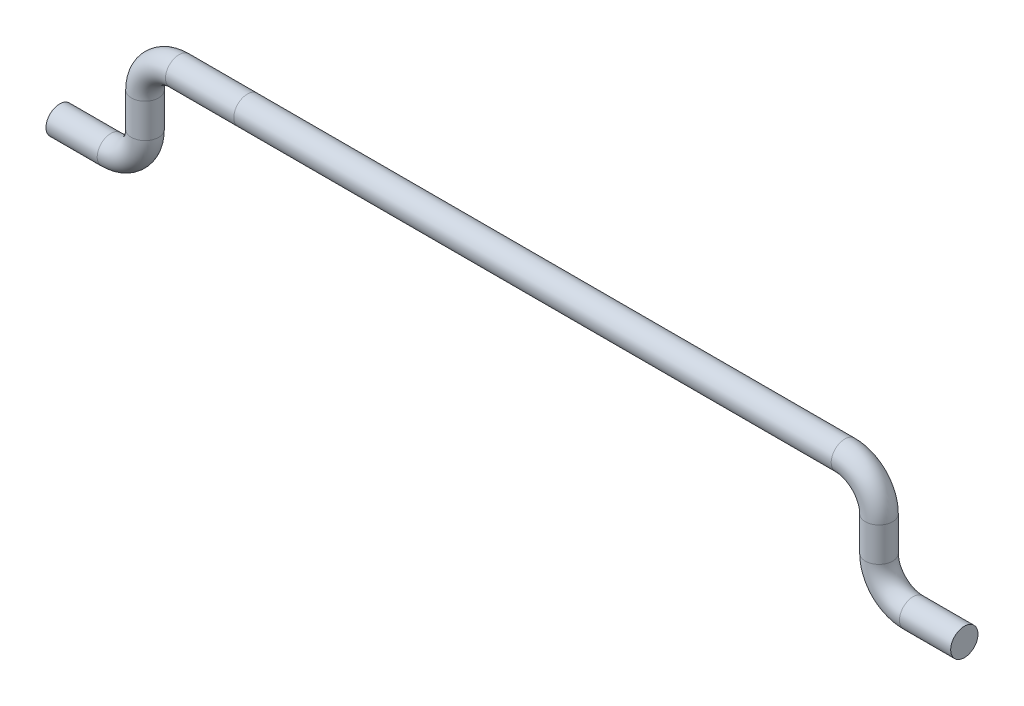
from build123d import *

# Parameters (mm, degrees)
SWEEP2_PROFILE_R = 1.016


with BuildPart() as part:
    # Sweep2: sweep along a path in Sketch12
    with BuildLine(Plane.XY) as sweep2_path:
        Line((15.019045905, -7.62), (11.209045905, -7.62))
        ThreePointArc((11.209045905, -7.62), (9.412994681, -6.876051224), (8.669045905, -5.08))
        Line((8.669045905, -5.08), (8.669045905, -2.54))
        ThreePointArc((8.669045905, -2.54), (7.925097129, -0.743948776), (6.129045905, 0))
        Line((6.129045905, 0), (-38.320954095, 0))
        Line((-38.320954095, 0), (-43.400954095, 0))
        ThreePointArc((-43.400954095, 0), (-45.197005319, -0.743948776), (-45.940954095, -2.54))
        Line((-45.940954095, -2.54), (-45.940954095, -5.08))
        ThreePointArc((-45.940954095, -5.08), (-46.684902871, -6.876051224), (-48.480954095, -7.62))
        Line((-48.480954095, -7.62), (-52.290954095, -7.62))
    # Sweep2 profile (on start of the path) → Sweep2 (sweep)
    with BuildSketch(Plane(origin=(15.019045905, -7.62, 0), x_dir=(0, -1, 0), z_dir=(-1, 0, 0))):
        Circle(SWEEP2_PROFILE_R)
    sweep(path=sweep2_path.line)


solid = part.part
